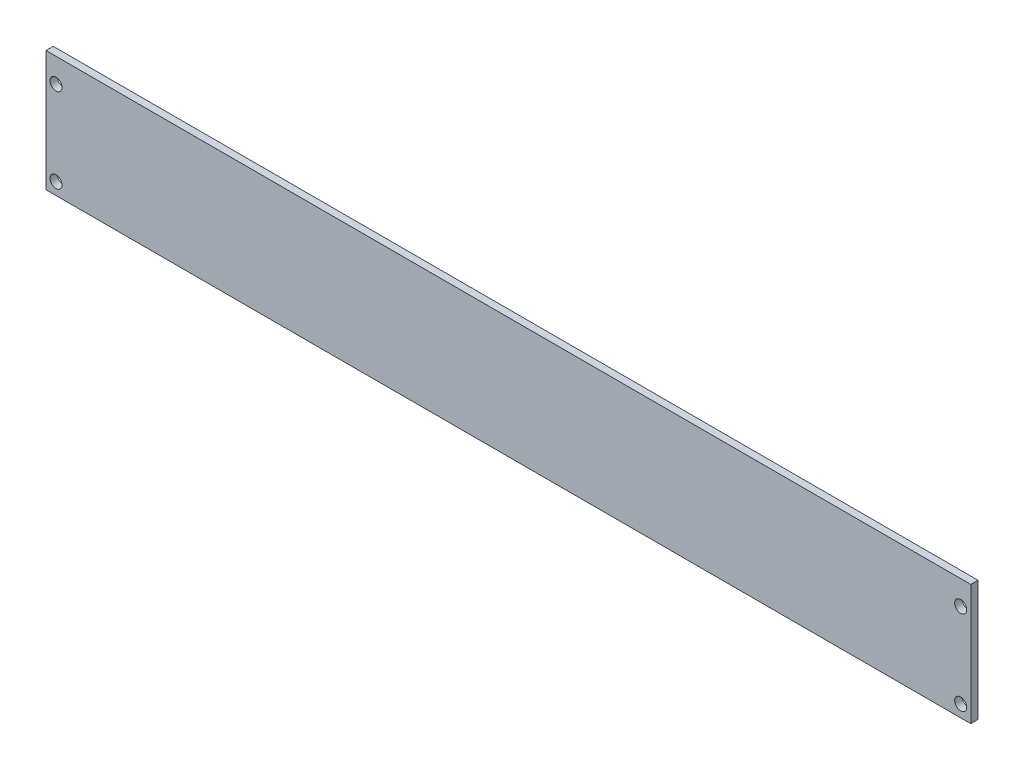
from build123d import *

# Parameters (mm, degrees)
SKETCH1_W           = 292.1
SKETCH1_H           = 38.1
SKETCH1_R           = 1.89865
BOSS_EXTRUDE1_DEPTH = 2.286


with BuildPart() as part:
    # Sketch1 → Boss-Extrude1 (new body)
    with BuildSketch(Plane.XY):
        Rectangle(SKETCH1_W, SKETCH1_H)
        with Locations((-142.875, 11.43)):
            Circle(SKETCH1_R, mode=Mode.SUBTRACT)
        with Locations((-142.875, -15.24)):
            Circle(SKETCH1_R, mode=Mode.SUBTRACT)
        with Locations((142.875, 11.43)):
            Circle(SKETCH1_R, mode=Mode.SUBTRACT)
        with Locations((142.875, -15.24)):
            Circle(SKETCH1_R, mode=Mode.SUBTRACT)
    extrude(amount=BOSS_EXTRUDE1_DEPTH)


solid = part.part
